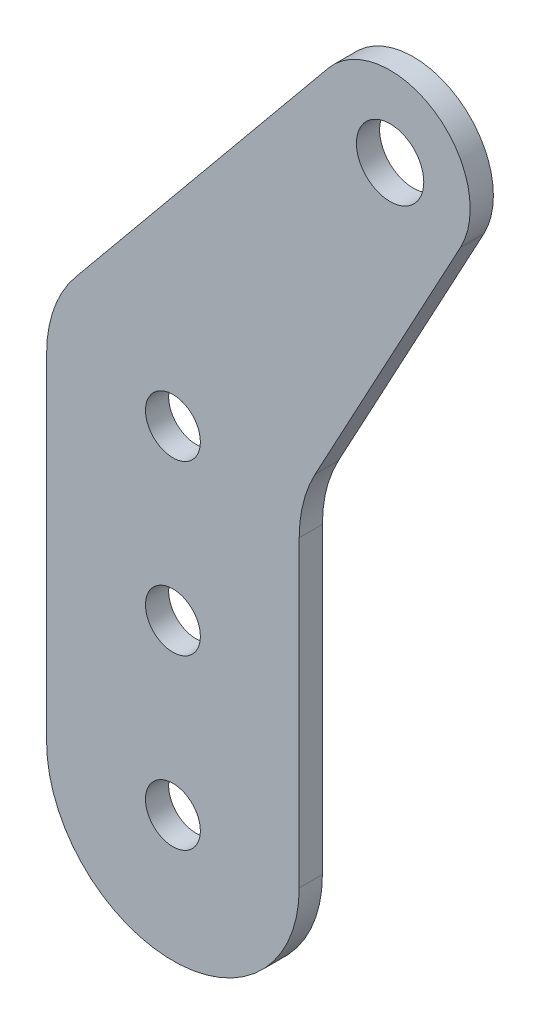
from build123d import *

# Parameters (mm, degrees)
SKETCH1_R           = 6.04
SKETCH1_R_2         = 2.54
SKETCH1_R_3         = 9.525
SKETCH1_R_4         = 2.07
BOSS_EXTRUDE1_DEPTH = 0.875
FILLET2_R           = 10


with BuildPart() as part:
    # Sketch1 → Boss-Extrude1 (new, symmetric)
    # profile 1 of 5: a face of its own
    with BuildSketch(Plane.XY):
        with Locations((16.38, 50.8)):
            Circle(SKETCH1_R)
        with Locations((16.38, 50.8)):
            Circle(SKETCH1_R_2, mode=Mode.SUBTRACT)
    # profile 2 of 5: a face of its own
    with BuildSketch(Plane.XY):
        with Locations((0, 25.4)):
            Circle(SKETCH1_R_3)
        with Locations((0, 25.4)):
            Circle(SKETCH1_R_4, mode=Mode.SUBTRACT)
    # profile 3 of 5: a face of its own
    with BuildSketch(Plane.XY):
        with BuildLine():
            ThreePointArc((-7.356213705, 31.450763995), (3.213852008, 34.366425167), (9.525, 25.4))
            Line((9.525, 25.4), (21.694295801, 47.929484342))
            ThreePointArc((21.694295801, 47.929484342), (13.010594873, 45.787145615), (11.715272359, 54.636914912))
            Line((11.715272359, 54.636914912), (-7.356213705, 31.450763995))
        make_face()
    # profile 4 of 5: a face of its own
    with BuildSketch(Plane.XY):
        with BuildLine():
            Line((9.525, 0), (9.525, 25.4))
            ThreePointArc((9.525, 25.4), (0, 15.875), (-9.525, 25.4))
            Line((-9.525, 25.4), (-9.525, 0))
            ThreePointArc((-9.525, 0), (0, 9.525), (9.525, 0))
        make_face()
        with Locations((0, 12.7)):
            Circle(SKETCH1_R_4, mode=Mode.SUBTRACT)
    # profile 5 of 5: a face of its own
    with BuildSketch(Plane.XY):
        Circle(SKETCH1_R_3)
        Circle(SKETCH1_R_4, mode=Mode.SUBTRACT)
    extrude(amount=BOSS_EXTRUDE1_DEPTH, both=True)

    # Fillet2
    fillet2_edges = [part.edges().sort_by_distance(p)[0] for p in [
        (9.525, 25.4, 0),
    ]]
    fillet(fillet2_edges, radius=FILLET2_R)


solid = part.part
